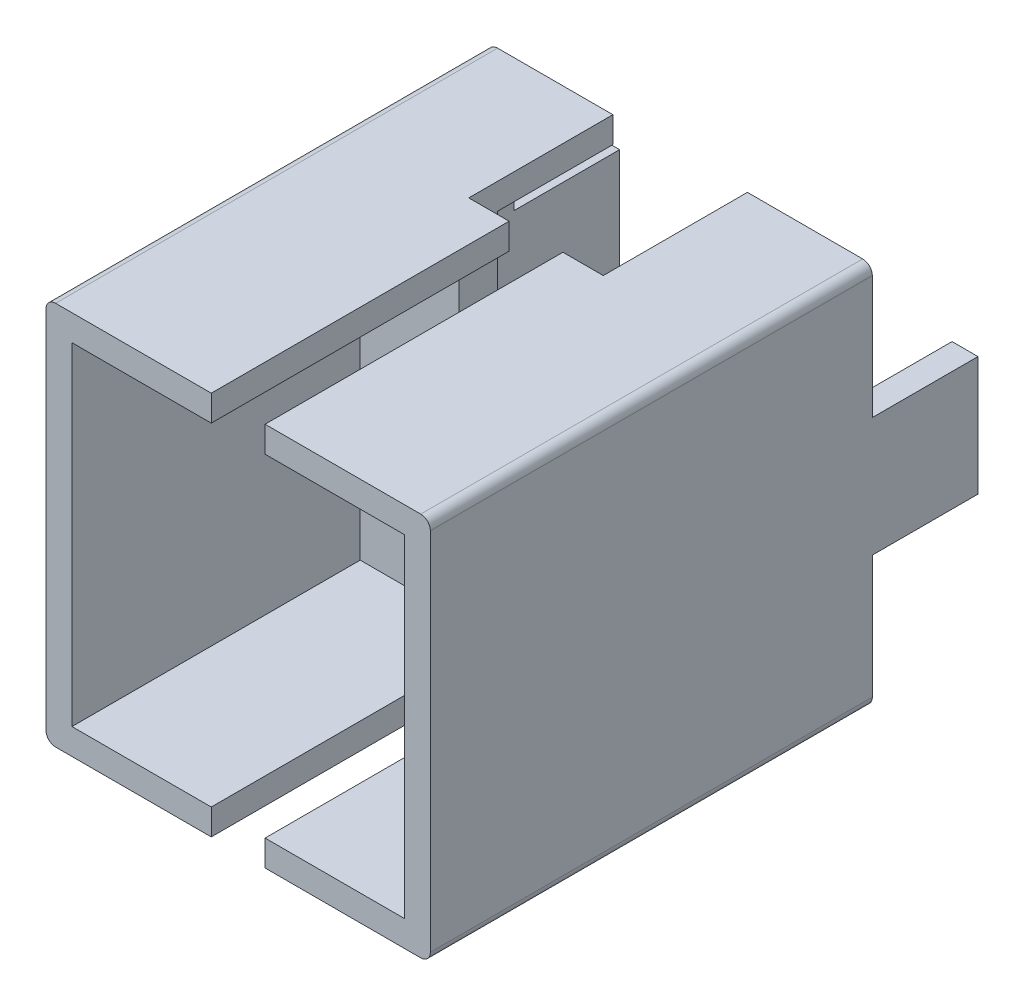
from build123d import *

# Parameters (mm, degrees)
BOSS_EXTRUDE1_DEPTH      = 23
BOSS_EXTRUDE1_2_DEPTH    = 23
SKETCH2_W                = 7
SKETCH2_H                = 7.5
CUT_EXTRUDE1_DEPTH       = 22
BOSS_EXTRUDE2_DEPTH      = 1.5
BOSS_EXTRUDE2_DEPTH_BACK = 0.5
FILLET1_R                = 0.5
SKETCH4_R                = 3.5
SKETCH4_R_2              = 2.5
BOSS_EXTRUDE3_DEPTH      = 5.5
SKETCH5_W                = 1.35
SKETCH5_H                = 6.2
BOSS_EXTRUDE4_DEPTH      = 5.5


with BuildPart() as part:
    # Sketch1 → Boss-Extrude1 (new body)
    with BuildSketch(Plane.XY):
        Polygon((-8.65, 8.65), (-1.4, 8.65), (-1.4, 10), (-10, 10), (-10, -10), (-1.4, -10), (-1.4, -8.65), (-8.65, -8.65), align=None)
    extrude(amount=-BOSS_EXTRUDE1_DEPTH)


with BuildPart() as body_2:
    # Sketch1 → Boss-Extrude1 2 (new body)
    with BuildSketch(Plane.XY):
        Polygon((10, -10), (10, 10), (1.4, 10), (1.4, 8.65), (8.65, 8.65), (8.65, -8.65), (1.4, -8.65), (1.4, -10), align=None)
    extrude(amount=-BOSS_EXTRUDE1_2_DEPTH)


with BuildPart() as cut_extrude1_tool:
    # Sketch2 → Cut-Extrude1 (new body)
    with BuildSketch(Plane.XZ.offset(10)):
        with Locations((0, -19.25)):
            Rectangle(SKETCH2_W, SKETCH2_H)
    extrude(amount=-CUT_EXTRUDE1_DEPTH)


with BuildPart() as part_1:
    add(part.part)

    # Cut-Extrude1: cut by cut_extrude1_tool
    add(cut_extrude1_tool.part, mode=Mode.SUBTRACT)



with BuildPart() as body_2_1:
    add(body_2.part)

    # Cut-Extrude1: cut by cut_extrude1_tool
    add(cut_extrude1_tool.part, mode=Mode.SUBTRACT)


with BuildPart() as part_2:
    add(part_1.part)

    add(body_2_1.part)  # Boss-Extrude2 merges body 2
    # Sketch3 → Boss-Extrude2 (add, two sides: drawn at the far end of the back side and taken through both)
    with BuildSketch(Plane(origin=(0, 0, -15.5), x_dir=(-1, 0, 0), z_dir=(0, 0, -1)).offset(-BOSS_EXTRUDE2_DEPTH_BACK)):
        Polygon((8.65, 8.65), (3.5, 8.65), (3.5, 5), (-3.5, 5), (-3.5, 8.65), (-8.65, 8.65), (-8.65, -8.65), (-3.5, -8.65), (-3.5, -5), (3.5, -5), (3.5, -8.65), (8.65, -8.65), align=None)
    extrude(amount=BOSS_EXTRUDE2_DEPTH + BOSS_EXTRUDE2_DEPTH_BACK)

    # Fillet1
    fillet1_edges = [part_2.edges().sort_by_distance(p)[0] for p in [
        (10, 10, -11.5),
        (10, -10, -11.5),
        (-10, -10, -11.5),
        (-10, 10, -11.5),
    ]]
    fillet(fillet1_edges, radius=FILLET1_R)

    # Sketch4 → Boss-Extrude3 (add)
    with BuildSketch(Plane(origin=(0, 0, -17), x_dir=(-1, 0, 0), z_dir=(0, 0, -1))):
        with Locations(Location((0, 0, 0), (0, 0, 180))):
            Circle(SKETCH4_R)
        Circle(SKETCH4_R_2, mode=Mode.SUBTRACT)
    extrude(amount=BOSS_EXTRUDE3_DEPTH)

    # Sketch5 → Boss-Extrude4 (add)
    with BuildSketch(Plane(origin=(0, 0, -23), x_dir=(-1, 0, 0), z_dir=(0, 0, -1))):
        with Locations((-9.325, 0)):
            Rectangle(SKETCH5_W, SKETCH5_H)
        with Locations((9.325, 0)):
            Rectangle(SKETCH5_W, SKETCH5_H)
    extrude(amount=BOSS_EXTRUDE4_DEPTH)


solid = part_2.part
